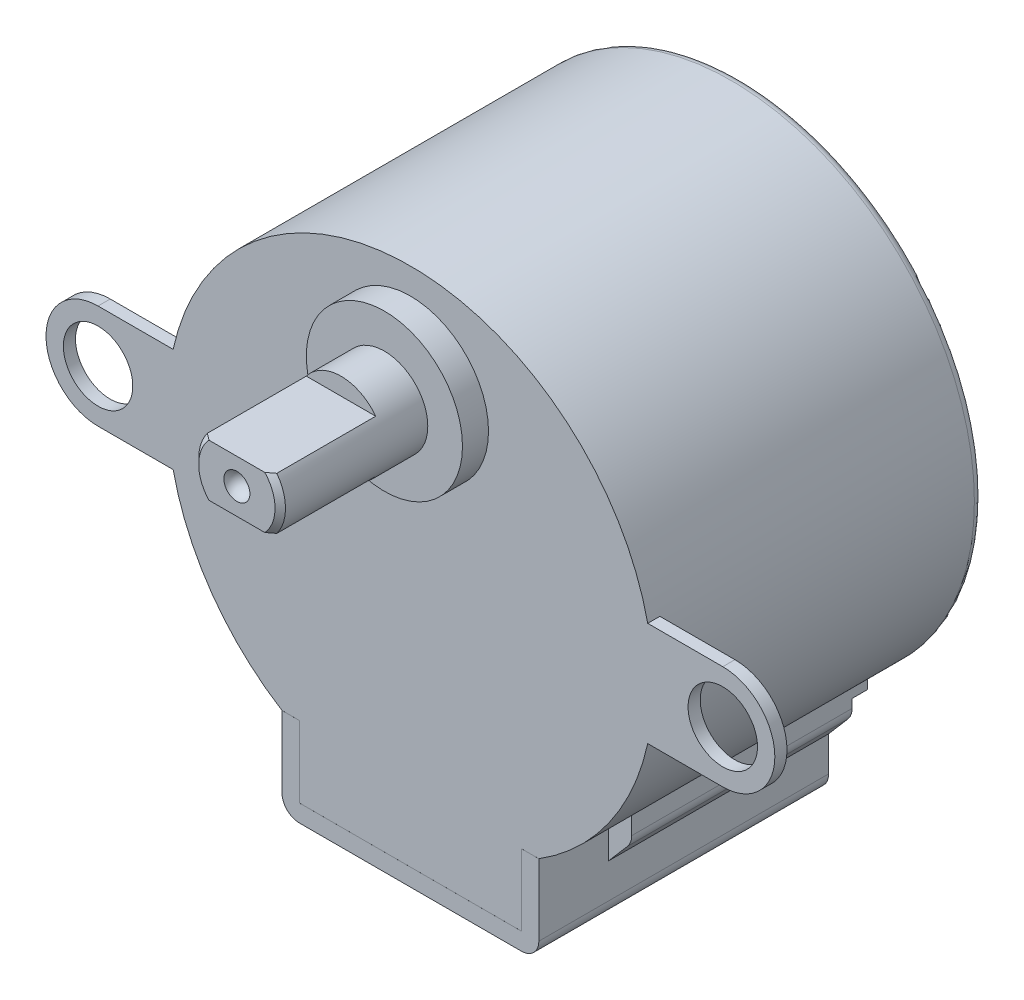
from build123d import *

# Parameters (mm, degrees)
IZIM1_R                     = 14
Y_KSEKLIK_EKSTR_ZYON1_DEPTH = 19
IZIM2_R                     = 4.5
Y_KSEKLIK_EKSTR_ZYON2_DEPTH = 1.5
IZIM3_R                     = 2.5
Y_KSEKLIK_EKSTR_ZYON3_DEPTH = 8.5
KES_EKSTR_ZYON1_DEPTH       = 6
PAH1_SIZE                   = 0.3
Y_KSEKLIK_EKSTR_ZYON4_START = -16.7
Y_KSEKLIK_EKSTR_ZYON4_DEPTH = 16.7
RADYUS2_R                   = 1
Y_KSEKLIK_EKSTR_ZYON5_DEPTH = 12.7
Y_KSEKLIK_EKSTR_ZYON6_START = 0.9
Y_KSEKLIK_EKSTR_ZYON6_DEPTH = 0.9
KES_EKSTR_ZYON2_DEPTH       = 2.3
RADYUS3_R                   = 0.5
Y_KSEKLIK_EKSTR_ZYON7_START = -0.7
IZIM10_R                    = 2
Y_KSEKLIK_EKSTR_ZYON7_DEPTH = 0.7
IZIM11_W                    = 1.346153846
IZIM11_H                    = 0.358974359
KES_EKSTR_ZYON3_DEPTH       = 0.3
Y_KSEKLIK_EKSTR_ZYON8_START = 0.001
Y_KSEKLIK_EKSTR_ZYON8_DEPTH = 0.001


with BuildPart() as part:
    # Çizim1 → Yükseklik-Ekstrüzyon1 (new body)
    with BuildSketch(Plane.XY):
        Circle(IZIM1_R)
    extrude(amount=Y_KSEKLIK_EKSTR_ZYON1_DEPTH)

    # Çizim2 → Yükseklik-Ekstrüzyon2 (add)
    with BuildSketch(Plane.XY.offset(19)):
        with Locations((0, 8)):
            Circle(IZIM2_R)
    extrude(amount=Y_KSEKLIK_EKSTR_ZYON2_DEPTH)

    # Çizim3 → Yükseklik-Ekstrüzyon3 (add)
    with BuildSketch(Plane.XY.offset(20.5)):
        with Locations((0, 8)):
            Circle(IZIM3_R)
    extrude(amount=Y_KSEKLIK_EKSTR_ZYON3_DEPTH)

    # Çizim4 → Kes-Ekstrüzyon1 (cut)
    with BuildSketch(Plane.XY.offset(29)):
        Polygon((0, 9.5), (2.176763418, 9.5), (2.176763418, 10.5), (-2.399726215, 10.5), (-2.399726215, 9.5), align=None)
        Polygon((2.176763418, 5.5), (-2.399726215, 5.5), (-2.399726215, 6.5), (0, 6.5), (2.176763418, 6.5), align=None)
    extrude(amount=-KES_EKSTR_ZYON1_DEPTH, mode=Mode.SUBTRACT)

    # Pah1
    pah1_edges = [part.edges().sort_by_distance(p)[0] for p in [
        (-2.5, 8, 29),
        (2.371708245, 8.790569415, 29),
    ]]
    chamfer(pah1_edges, length=PAH1_SIZE)

    # Çizim5 → Kes-Döndür1 (revolve, cut)
    with BuildSketch(Plane.XY.offset(29)):
        with BuildLine():
            Line((0, 8.75), (0, 7.25))
            ThreePointArc((0, 7.25), (0.75, 8), (0, 8.75))
        make_face()
    revolve(axis=Axis((0, 8.75, 29), (0, -1, 0)), mode=Mode.SUBTRACT)

    # Çizim6 → Yükseklik-Ekstrüzyon4 (add)
    with BuildSketch(Plane.XY.offset(19).offset(Y_KSEKLIK_EKSTR_ZYON4_START)):
        with BuildLine():
            Line((0, -17), (7.4, -17))
            Line((7.4, -17), (7.4, -11.884443613))
            ThreePointArc((7.4, -11.884443613), (0, -14), (-7.4, -11.884443613))
            Line((-7.4, -11.884443613), (-7.4, -17))
            Line((-7.4, -17), (0, -17))
        make_face()
    extrude(amount=Y_KSEKLIK_EKSTR_ZYON4_DEPTH)

    # Radyus2
    radyus2_edges = [part.edges().sort_by_distance(p)[0] for p in [
        (-7.4, -17, 10.65),
        (7.4, -17, 10.65),
    ]]
    fillet(radyus2_edges, radius=RADYUS2_R)

    # Çizim7 → Yükseklik-Ekstrüzyon5 (add)
    with BuildSketch(Plane(origin=(0, 0, 2.3), x_dir=(-1, 0, 0), z_dir=(0, 0, -1))):
        with BuildLine():
            Line((7.4, -14), (7.4, -10.928746497))
            Line((7.4, -10.928746497), (8.75, -10.928746497))
            Line((8.75, -10.928746497), (8.75, -12.058153251))
            ThreePointArc((8.75, -12.058153251), (8.687680677, -12.405651377), (8.508490105, -12.709837807))
            Line((8.508490105, -12.709837807), (7.4, -14))
        make_face()
        with BuildLine():
            Line((-7.4, -14), (-7.4, -10.928746497))
            Line((-7.4, -10.928746497), (-8.75, -10.928746497))
            Line((-8.75, -10.928746497), (-8.75, -12.058153251))
            ThreePointArc((-8.75, -12.058153251), (-8.687680677, -12.405651377), (-8.508490105, -12.709837807))
            Line((-8.508490105, -12.709837807), (-7.4, -14))
        make_face()
    extrude(amount=-Y_KSEKLIK_EKSTR_ZYON5_DEPTH)

    # Çizim8 → Yükseklik-Ekstrüzyon6 (add)
    with BuildSketch(Plane(origin=(0, 0, 2.3), x_dir=(-1, 0, 0), z_dir=(0, 0, -1)).offset(Y_KSEKLIK_EKSTR_ZYON6_START)):
        with BuildLine():
            Line((-8.75, -10.928746497), (-8.75, -11.56233108))
            ThreePointArc((-8.75, -11.56233108), (-5.320746645, -13.488500849), (-1.5, -14.422205102))
            Line((-1.5, -14.422205102), (-1.5, -13.919410907))
            ThreePointArc((-1.5, -13.919410907), (-5.338693043, -12.942115615), (-8.75, -10.928746497))
        make_face()
        with BuildLine():
            Line((8.75, -10.928746497), (8.75, -11.56233108))
            ThreePointArc((8.75, -11.56233108), (5.320746645, -13.488500849), (1.5, -14.422205102))
            Line((1.5, -14.422205102), (1.5, -13.919410907))
            ThreePointArc((1.5, -13.919410907), (5.338693043, -12.942115615), (8.75, -10.928746497))
        make_face()
    extrude(amount=-Y_KSEKLIK_EKSTR_ZYON6_DEPTH)

    # Çizim9 → Kes-Ekstrüzyon2 (cut)
    with BuildSketch(Plane.XZ.offset(17)):
        with BuildLine():
            Line((3.2, 17), (-3.2, 17))
            ThreePointArc((-3.2, 17), (-3.7, 16.5), (-3.2, 16))
            Line((-3.2, 16), (3.2, 16))
            ThreePointArc((3.2, 16), (3.7, 16.5), (3.2, 17))
        make_face()
    extrude(amount=-KES_EKSTR_ZYON2_DEPTH, mode=Mode.SUBTRACT)

    # Radyus3
    radyus3_edges = [part.edges().sort_by_distance(p)[0] for p in [
        (-14, 0, 0),
    ]]
    fillet(radyus3_edges, radius=RADYUS3_R)

    # Çizim10 → Yükseklik-Ekstrüzyon7 (add)
    # profile 1 of 2: a face of its own
    with BuildSketch(Plane.XY.offset(19).offset(Y_KSEKLIK_EKSTR_ZYON7_START)):
        with BuildLine():
            Line((18, 3), (13.674794331, 3))
            ThreePointArc((13.674794331, 3), (14, 0), (13.674794331, -3))
            Line((13.674794331, -3), (18, -3))
            ThreePointArc((18, -3), (21, 0), (18, 3))
        make_face()
        with Locations((18, 0)):
            Circle(IZIM10_R, mode=Mode.SUBTRACT)
    # profile 2 of 2: a face of its own
    with BuildSketch(Plane.XY.offset(19).offset(Y_KSEKLIK_EKSTR_ZYON7_START)):
        with BuildLine():
            Line((-18, -3), (-13.674794331, -3))
            ThreePointArc((-13.674794331, -3), (-14, 0), (-13.674794331, 3))
            Line((-13.674794331, 3), (-18, 3))
            ThreePointArc((-18, 3), (-21, 0), (-18, -3))
        make_face()
        with Locations(Location((-18, 0, 0), (0, 0, 180))):
            Circle(IZIM10_R, mode=Mode.SUBTRACT)
    extrude(amount=Y_KSEKLIK_EKSTR_ZYON7_DEPTH)

    # Çizim11 → Kes-Ekstrüzyon3 (cut)
    # profile 1 of 8: a face of its own
    with BuildSketch(Plane(origin=(0, 0, 0), x_dir=(-1, 0, 0), z_dir=(0, 0, -1))):
        with BuildLine():
            Line((-9.138088726, 0.683464408), (-9.45219129, 0.683464408))
            add(Edge.make_bspline(
                [(-9.45219129, 0.683464408), (-9.450144137, 0.725135295), (-9.446123583, 0.80697581), (-9.427295294, 0.926299716), (-9.400354417, 1.040354515), (-9.362262963, 1.148224429), (-9.314956685, 1.250863236), (-9.258226658, 1.347863252), (-9.191032807, 1.438854441), (-9.114826073, 1.522993284), (-9.032057434, 1.600180855), (-8.942751494, 1.666836098), (-8.848906467, 1.723153769), (-8.750807068, 1.770235011), (-8.647346505, 1.805574857), (-8.539463647, 1.831796496), (-8.42668451, 1.847572842), (-8.349844488, 1.849268628), (-8.310765008, 1.850131074)],
                knots=[0, 0, 0, 0, 1.10065271, 2.161652631, 3.183658789, 4.190468796, 5.17591951, 6.163126047, 7.15150782, 8.156236427, 9.156009102, 10.134482811, 11.092018607, 12.041330605, 13.001268258, 13.972401359, 14.968799086, 16, 16, 16, 16], degree=3))
            add(Edge.make_bspline(
                [(-8.310765008, 1.850131074), (-8.272386934, 1.849232618), (-8.196975389, 1.847467183), (-8.086913375, 1.832306154), (-7.982136081, 1.808560562), (-7.882848314, 1.775245146), (-7.789842249, 1.730460718), (-7.702419205, 1.67666318), (-7.619538394, 1.614443348), (-7.54493161, 1.541189535), (-7.476423531, 1.46298715), (-7.417321276, 1.379499247), (-7.366708113, 1.293269961), (-7.324520433, 1.203641759), (-7.293464294, 1.109770731), (-7.269886086, 1.013023528), (-7.256558672, 0.912398717), (-7.254513249, 0.844292162), (-7.253473341, 0.809666331)],
                knots=[0, 0, 0, 0, 1.111607364, 2.184268762, 3.212621178, 4.221274766, 5.211760367, 6.196651075, 7.1921475, 8.207485113, 9.220403448, 10.201281604, 11.166441695, 12.114753415, 13.065576456, 14.026450734, 14.996634279, 16, 16, 16, 16], degree=3))
            add(Edge.make_bspline(
                [(-7.253473341, 0.809666331), (-7.255166604, 0.760918496), (-7.258523416, 0.664278282), (-7.287237792, 0.52226342), (-7.332084303, 0.384670001), (-7.38608166, 0.273932698), (-7.440554104, 0.184699205), (-7.489641612, 0.1112305), (-7.547106423, 0.032125031), (-7.613784921, -0.052352306), (-7.688297793, -0.142863211), (-7.771319956, -0.239353006), (-7.863443438, -0.340824776), (-7.928101939, -0.410130378), (-7.961606354, -0.446042804)],
                knots=[0, 0, 0, 0, 1.184426356, 2.348067706, 3.509069118, 4.696110526, 5.333549288, 6.050745305, 6.844228056, 7.710549037, 8.667450064, 9.695053472, 10.805634456, 12, 12, 12, 12], degree=3))
            Line((-7.961606354, -0.446042804), (-8.837307476, -1.380638157))
            Line((-8.837307476, -1.380638157), (-7.208601547, -1.380638157))
            Line((-7.208601547, -1.380638157), (-7.208601547, -1.739612516))
            Line((-7.208601547, -1.739612516), (-9.586806675, -1.739612516))
            Line((-9.586806675, -1.739612516), (-8.22943488, -0.291094887))
            add(Edge.make_bspline(
                [(-8.22943488, -0.291094887), (-8.196386993, -0.256596581), (-8.132908766, -0.190332394), (-8.043126189, -0.093589434), (-7.962487201, -0.003839893), (-7.890469808, 0.078746655), (-7.828636303, 0.155378223), (-7.773764071, 0.223572927), (-7.72979848, 0.286327377), (-7.682083084, 0.359067991), (-7.635869103, 0.447880308), (-7.596156747, 0.556413997), (-7.571941898, 0.66814125), (-7.569037063, 0.743643287), (-7.567575906, 0.781621459)],
                knots=[0, 0, 0, 0, 1.329631726, 2.553950428, 3.673215718, 4.687767853, 5.603093632, 6.413772471, 7.123043292, 7.734684054, 8.834405432, 9.900288307, 10.943827018, 12, 12, 12, 12], degree=3))
            add(Edge.make_bspline(
                [(-7.567575906, 0.781621459), (-7.568211648, 0.805502857), (-7.569464574, 0.852568508), (-7.580522271, 0.921574267), (-7.597232777, 0.98813908), (-7.621178036, 1.0524677), (-7.652784776, 1.113913352), (-7.691258156, 1.172550832), (-7.735648219, 1.229239797), (-7.786999488, 1.282393095), (-7.843411008, 1.331074301), (-7.903005258, 1.374198386), (-7.966055362, 1.410237497), (-8.032295484, 1.439780994), (-8.101540954, 1.462956375), (-8.173925699, 1.479014955), (-8.249249715, 1.489097439), (-8.300683211, 1.49046161), (-8.326890809, 1.491156715)],
                knots=[0, 0, 0, 0, 0.991446411, 1.95395049, 2.89581595, 3.838931463, 4.798493298, 5.75982156, 6.748411868, 7.785213223, 8.824556874, 9.840280684, 10.836137867, 11.835679398, 12.848801643, 13.863922112, 14.911575587, 16, 16, 16, 16], degree=3))
            add(Edge.make_bspline(
                [(-8.326890809, 1.491156715), (-8.354261642, 1.490441683), (-8.408013438, 1.489037478), (-8.486932471, 1.479214814), (-8.562218249, 1.462268973), (-8.634060152, 1.439092299), (-8.702579738, 1.40963375), (-8.767443782, 1.372942005), (-8.828506671, 1.329158512), (-8.885883194, 1.279517956), (-8.938747173, 1.224250355), (-8.985194049, 1.162640392), (-9.025778063, 1.095812976), (-9.061187297, 1.023948426), (-9.089942987, 0.946394646), (-9.111916137, 0.863426941), (-9.129302984, 0.775405559), (-9.135111505, 0.714620475), (-9.138088726, 0.683464408)],
                knots=[0, 0, 0, 0, 1.031018746, 2.02475058, 2.990194455, 3.934040569, 4.864654155, 5.795059489, 6.735614925, 7.690564532, 8.649604399, 9.611025574, 10.590972636, 11.591080095, 12.624614302, 13.701020113, 14.821632451, 16, 16, 16, 16], degree=3))
        make_face()
    # profile 2 of 8: a face of its own
    with BuildSketch(Plane(origin=(0, 0, 0), x_dir=(-1, 0, 0), z_dir=(0, 0, -1))):
        with BuildLine():
            add(Edge.make_bspline(
                [(-5.192876386, 0.210207196), (-5.164227839, 0.19526924), (-5.108353605, 0.166135237), (-5.028776396, 0.119224409), (-4.956051395, 0.069783445), (-4.888160833, 0.020147585), (-4.826297483, -0.031584066), (-4.77115307, -0.085617222), (-4.72136545, -0.140603168), (-4.677938666, -0.197473008), (-4.639741829, -0.256075657), (-4.606729694, -0.31656493), (-4.578512491, -0.378808264), (-4.556149552, -0.443485094), (-4.537727761, -0.509645355), (-4.525052156, -0.578143337), (-4.518235238, -0.648527678), (-4.516946424, -0.69609598), (-4.516293854, -0.720181426)],
                knots=[0, 0, 0, 0, 1.272397273, 2.481599622, 3.635517121, 4.734568067, 5.792894095, 6.808321871, 7.773003508, 8.711915296, 9.623354172, 10.525449501, 11.423591555, 12.311487226, 13.218079475, 14.126165749, 15.051214107, 16, 16, 16, 16], degree=3))
            add(Edge.make_bspline(
                [(-4.516293854, -0.720181426), (-4.517065275, -0.753879158), (-4.518592206, -0.820579615), (-4.53189219, -0.919025727), (-4.551805168, -1.014637509), (-4.58088468, -1.107393999), (-4.618598071, -1.196783373), (-4.665074907, -1.282882146), (-4.717686112, -1.367101455), (-4.759938352, -1.418920857), (-4.781317893, -1.445141362)],
                knots=[0, 0, 0, 0, 1.025265484, 2.029385089, 3.018602448, 3.995076438, 4.983346944, 5.966715145, 6.97116228, 8, 8, 8, 8], degree=3))
            add(Edge.make_bspline(
                [(-4.781317893, -1.445141362), (-4.809154367, -1.475735136), (-4.864483333, -1.536544629), (-4.95926626, -1.615495439), (-5.063288144, -1.681844833), (-5.176146477, -1.735916727), (-5.297539578, -1.778002586), (-5.427441583, -1.808245104), (-5.566105736, -1.825567533), (-5.661411207, -1.828071523), (-5.710304271, -1.829356105)],
                knots=[0, 0, 0, 0, 0.954267603, 1.896743057, 2.838368354, 3.796610408, 4.779680527, 5.799409237, 6.871065594, 8, 8, 8, 8], degree=3))
            add(Edge.make_bspline(
                [(-5.710304271, -1.829356105), (-5.75731766, -1.828203627), (-5.848800939, -1.825961022), (-5.981958816, -1.810766591), (-6.106081886, -1.784138724), (-6.221891854, -1.747694115), (-6.328690548, -1.700283886), (-6.426173649, -1.641275478), (-6.515747621, -1.573044035), (-6.594694095, -1.493629957), (-6.664782538, -1.408572085), (-6.726350592, -1.320820475), (-6.77752467, -1.230367118), (-6.820851765, -1.13856075), (-6.854019788, -1.044114596), (-6.876991998, -0.947514583), (-6.891581312, -0.84892944), (-6.893522447, -0.782397787), (-6.894498983, -0.748927419)],
                knots=[0, 0, 0, 0, 1.256902934, 2.445805442, 3.576955095, 4.645999104, 5.686449165, 6.692658513, 7.68621702, 8.689161843, 9.678783111, 10.630372946, 11.551080876, 12.453998257, 13.34127905, 14.221779781, 15.105423033, 16, 16, 16, 16], degree=3))
            add(Edge.make_bspline(
                [(-6.894498983, -0.748927419), (-6.893921101, -0.724368227), (-6.892779005, -0.675830595), (-6.884874156, -0.604121267), (-6.872165695, -0.534325132), (-6.854906238, -0.466184389), (-6.831515212, -0.400195116), (-6.803273079, -0.336044643), (-6.770341126, -0.273660544), (-6.732259961, -0.212701663), (-6.687957937, -0.15402215), (-6.637794287, -0.096626156), (-6.580766419, -0.041404289), (-6.51750876, 0.012318136), (-6.44874422, 0.06549411), (-6.37268669, 0.115249839), (-6.291352422, 0.165107804), (-6.233547016, 0.194916129), (-6.203894015, 0.210207196)],
                knots=[0, 0, 0, 0, 0.941657376, 1.861047343, 2.762797495, 3.66048619, 4.553285746, 5.444104102, 6.34607688, 7.256116206, 8.197091036, 9.162375105, 10.176350973, 11.237807142, 12.343728897, 13.50695164, 14.721116704, 16, 16, 16, 16], degree=3))
            add(Edge.make_bspline(
                [(-6.203894015, 0.210207196), (-6.244485389, 0.232341965), (-6.323081652, 0.275201072), (-6.427151093, 0.353947878), (-6.516541717, 0.439235693), (-6.588796434, 0.532865488), (-6.645668662, 0.631912362), (-6.684687267, 0.735756615), (-6.711083751, 0.842472728), (-6.713698578, 0.915378925), (-6.715011803, 0.951994055)],
                knots=[0, 0, 0, 0, 1.166880483, 2.259407225, 3.286803203, 4.280235371, 5.237608625, 6.161067461, 7.076446754, 8, 8, 8, 8], degree=3))
            add(Edge.make_bspline(
                [(-6.715011803, 0.951994055), (-6.713376379, 0.989291613), (-6.710088891, 1.06426621), (-6.683505571, 1.175872334), (-6.640185504, 1.285488899), (-6.581264507, 1.392584611), (-6.507877291, 1.493534826), (-6.419830745, 1.584075772), (-6.319227448, 1.663387255), (-6.206569581, 1.729963428), (-6.085333346, 1.784147086), (-5.957417622, 1.821525509), (-5.825051129, 1.845961626), (-5.734953409, 1.848728281), (-5.689270617, 1.850131074)],
                knots=[0, 0, 0, 0, 0.888701115, 1.786444228, 2.72001202, 3.692817113, 4.693886446, 5.687152267, 6.695133018, 7.739871481, 8.800368666, 9.853104506, 10.91144658, 12, 12, 12, 12], degree=3))
            add(Edge.make_bspline(
                [(-5.689270617, 1.850131074), (-5.644766802, 1.848684731), (-5.557010349, 1.845832707), (-5.428015721, 1.822045829), (-5.304590844, 1.782316309), (-5.187161345, 1.728419086), (-5.077829478, 1.662032145), (-4.981227168, 1.581631271), (-4.895894586, 1.491489721), (-4.825310192, 1.390570117), (-4.767147303, 1.283885924), (-4.726646402, 1.172263403), (-4.700694428, 1.058114344), (-4.697421063, 0.98087634), (-4.695781034, 0.94217835)],
                knots=[0, 0, 0, 0, 1.072916533, 2.115669174, 3.151510826, 4.193348718, 5.225979165, 6.227137561, 7.216255879, 8.211077061, 9.189680878, 10.138522389, 11.067357538, 12, 12, 12, 12], degree=3))
            add(Edge.make_bspline(
                [(-4.695781034, 0.94217835), (-4.697215594, 0.904201686), (-4.70003299, 0.829617677), (-4.72373293, 0.720891156), (-4.763646243, 0.619069117), (-4.818140406, 0.522996165), (-4.889165894, 0.434414667), (-4.975774627, 0.352198198), (-5.077276105, 0.275671369), (-5.153536991, 0.232485005), (-5.192876386, 0.210207196)],
                knots=[0, 0, 0, 0, 0.975232327, 1.915300861, 2.843280834, 3.77672583, 4.742871857, 5.749627742, 6.839139064, 8, 8, 8, 8], degree=3))
        make_face()
        with BuildLine():
            add(Edge.make_bspline(
                [(-5.706798662, 1.491156715), (-5.731349468, 1.490505275), (-5.779381579, 1.489230772), (-5.84981025, 1.482572135), (-5.916782617, 1.469618918), (-5.980998418, 1.452380207), (-6.04157723, 1.429092219), (-6.099341785, 1.401697209), (-6.153308975, 1.368391144), (-6.204130278, 1.331029946), (-6.249881052, 1.28993704), (-6.290485604, 1.247123321), (-6.324213718, 1.201747929), (-6.352854828, 1.154939569), (-6.373636345, 1.105308993), (-6.389200649, 1.054377817), (-6.39972204, 1.001502433), (-6.40051043, 0.965365922), (-6.400909239, 0.947086202)],
                knots=[0, 0, 0, 0, 1.203892937, 2.355340988, 3.463153438, 4.544400666, 5.610487187, 6.640501085, 7.674077295, 8.714426146, 9.728707835, 10.68524104, 11.601827946, 12.495867327, 13.368432065, 14.231010473, 15.105153427, 16, 16, 16, 16], degree=3))
            add(Edge.make_bspline(
                [(-6.400909239, 0.947086202), (-6.400221872, 0.928805693), (-6.398863536, 0.89268078), (-6.388358408, 0.839334914), (-6.372701553, 0.786913277), (-6.348050892, 0.736662366), (-6.318484534, 0.686839007), (-6.281993058, 0.638688421), (-6.23850403, 0.592043036), (-6.189476589, 0.547299595), (-6.136065052, 0.505400832), (-6.079481008, 0.46902765), (-6.020434617, 0.43859354), (-5.959532548, 0.413264135), (-5.8961541, 0.393574198), (-5.830687627, 0.379605551), (-5.763122125, 0.370923554), (-5.717341544, 0.369886533), (-5.69417847, 0.369361843)],
                knots=[0, 0, 0, 0, 0.873023192, 1.725219244, 2.590779336, 3.480155217, 4.391973325, 5.357036234, 6.360879153, 7.436073238, 8.526419356, 9.601555421, 10.645666583, 11.697338044, 12.750135903, 13.812665442, 14.89329948, 16, 16, 16, 16], degree=3))
            add(Edge.make_bspline(
                [(-5.69417847, 0.369361843), (-5.664428366, 0.370234711), (-5.605221998, 0.371971824), (-5.517942667, 0.388122997), (-5.433080022, 0.413528915), (-5.351541118, 0.448288881), (-5.275436533, 0.491916741), (-5.207596464, 0.544149759), (-5.148599572, 0.603781856), (-5.099058961, 0.669884692), (-5.060649115, 0.740236281), (-5.030747307, 0.810836573), (-5.013286092, 0.882438804), (-5.011008525, 0.930405768), (-5.009883598, 0.95409742)],
                knots=[0, 0, 0, 0, 1.076279235, 2.141928126, 3.20205304, 4.278698113, 5.344010996, 6.36967002, 7.368914609, 8.37248503, 9.349703398, 10.264243087, 11.142681841, 12, 12, 12, 12], degree=3))
            add(Edge.make_bspline(
                [(-5.009883598, 0.95409742), (-5.010415495, 0.970725456), (-5.011471236, 1.003729724), (-5.020171292, 1.05246809), (-5.034547125, 1.100097673), (-5.054010205, 1.147011944), (-5.07962, 1.192552676), (-5.109984187, 1.237435764), (-5.146868689, 1.280651528), (-5.188265122, 1.323207076), (-5.235210531, 1.3625911), (-5.287614443, 1.39722581), (-5.345208193, 1.426638167), (-5.407993143, 1.450526921), (-5.475738067, 1.468469271), (-5.548130942, 1.481905619), (-5.625775389, 1.48947873), (-5.67920514, 1.490585256), (-5.706798662, 1.491156715)],
                knots=[0, 0, 0, 0, 0.814439003, 1.616544685, 2.417341072, 3.248991801, 4.09997495, 4.973547432, 5.9003056, 6.880240646, 7.880314356, 8.896779544, 9.951930927, 11.043077905, 12.18215768, 13.381699519, 14.647792085, 16, 16, 16, 16], degree=3))
        make_face(mode=Mode.SUBTRACT)
        with BuildLine():
            add(Edge.make_bspline(
                [(-5.68646613, 0.010387484), (-5.717591916, 0.009833843), (-5.778653112, 0.008747734), (-5.86811004, -0.003341767), (-5.953963206, -0.02017116), (-6.035923142, -0.045701998), (-6.113955239, -0.078898488), (-6.188481921, -0.118833028), (-6.258933051, -0.166038472), (-6.324335777, -0.219915087), (-6.384059107, -0.277974541), (-6.436457407, -0.339436676), (-6.480954927, -0.403159209), (-6.516788178, -0.469951438), (-6.54619991, -0.538399049), (-6.565513787, -0.610206644), (-6.577895499, -0.683993758), (-6.579558131, -0.734153856), (-6.580396418, -0.759444246)],
                knots=[0, 0, 0, 0, 1.140299081, 2.23698856, 3.303958914, 4.344563908, 5.37730929, 6.408454204, 7.439741482, 8.480804886, 9.510774543, 10.48932336, 11.43758569, 12.353841022, 13.263987381, 14.161954604, 15.073269652, 16, 16, 16, 16], degree=3))
            add(Edge.make_bspline(
                [(-6.580396418, -0.759444246), (-6.57903316, -0.790875152), (-6.576328486, -0.853233336), (-6.554871847, -0.945396407), (-6.520436312, -1.034617462), (-6.472411096, -1.120169415), (-6.412943523, -1.200119521), (-6.339817055, -1.269808297), (-6.257576218, -1.331729775), (-6.163438364, -1.381810309), (-6.060609897, -1.421805164), (-5.949118169, -1.449361126), (-5.83056325, -1.467602576), (-5.748703658, -1.469440757), (-5.706798662, -1.470381746)],
                knots=[0, 0, 0, 0, 0.898778495, 1.783155532, 2.693654817, 3.627872908, 4.583023416, 5.533784346, 6.509005473, 7.520592997, 8.575161974, 9.658835044, 10.801527049, 12, 12, 12, 12], degree=3))
            add(Edge.make_bspline(
                [(-5.706798662, -1.470381746), (-5.674048294, -1.469752938), (-5.610240075, -1.468527817), (-5.517154126, -1.457713523), (-5.429309578, -1.440563898), (-5.346876779, -1.415620353), (-5.268932939, -1.385170376), (-5.196799585, -1.345998295), (-5.128621058, -1.301445972), (-5.067756936, -1.248587815), (-5.012323727, -1.19210832), (-4.963990434, -1.132318277), (-4.922032883, -1.070842645), (-4.889101927, -1.00629216), (-4.862775674, -0.939905246), (-4.843852119, -0.871069734), (-4.832175904, -0.799574501), (-4.830995008, -0.75107543), (-4.830396418, -0.726491522)],
                knots=[0, 0, 0, 0, 1.224942928, 2.386581632, 3.501229538, 4.569074225, 5.605009692, 6.626002462, 7.634866581, 8.645888296, 9.63523824, 10.59253846, 11.518950513, 12.414518923, 13.29783783, 14.186679152, 15.080837789, 16, 16, 16, 16], degree=3))
            add(Edge.make_bspline(
                [(-4.830396418, -0.726491522), (-4.831302267, -0.702614181), (-4.833088442, -0.655532237), (-4.844425133, -0.58576571), (-4.864341011, -0.518362896), (-4.891668407, -0.45251289), (-4.92804937, -0.389549939), (-4.97089424, -0.327833768), (-5.022588359, -0.269077323), (-5.081000955, -0.212824227), (-5.144659916, -0.160808491), (-5.21232706, -0.114794052), (-5.283481522, -0.076041936), (-5.357972733, -0.04452544), (-5.435635289, -0.019737971), (-5.516412068, -0.002421975), (-5.600397643, 0.008477627), (-5.657452513, 0.009743673), (-5.68646613, 0.010387484)],
                knots=[0, 0, 0, 0, 0.917430815, 1.809013306, 2.70690318, 3.612392954, 4.541220862, 5.495268465, 6.494511384, 7.542276156, 8.608045339, 9.649016899, 10.681629292, 11.715607085, 12.752076957, 13.808767841, 14.885711793, 16, 16, 16, 16], degree=3))
        make_face(mode=Mode.SUBTRACT)
    # profile 3 of 8: a face of its own
    with BuildSketch(Plane(origin=(0, 0, 0), x_dir=(-1, 0, 0), z_dir=(0, 0, -1))):
        with BuildLine():
            Line((-3.888088726, 1.760387484), (-3.205196098, 1.760387484))
            add(Edge.make_bspline(
                [(-3.205196098, 1.760387484), (-3.17176762, 1.760211734), (-3.106974909, 1.759871086), (-3.012755468, 1.754587955), (-2.924506657, 1.747384285), (-2.842202885, 1.735954192), (-2.765882182, 1.722162415), (-2.695314545, 1.705460599), (-2.630724373, 1.685433985), (-2.553611636, 1.653587704), (-2.465690975, 1.606264536), (-2.370492583, 1.536335971), (-2.289088343, 1.450803508), (-2.218902026, 1.354320852), (-2.163100906, 1.24818508), (-2.122731609, 1.134925892), (-2.097173734, 1.01600415), (-2.0945453, 0.934360972), (-2.093216931, 0.893099824)],
                knots=[0, 0, 0, 0, 1.001505555, 1.941167018, 2.826882275, 3.653841531, 4.429895133, 5.150066043, 5.825578002, 6.45369114, 7.647487171, 8.808567382, 9.977351308, 11.170798116, 12.373658725, 13.556498008, 14.765093433, 16, 16, 16, 16], degree=3))
            add(Edge.make_bspline(
                [(-2.093216931, 0.893099824), (-2.09431015, 0.854447269), (-2.096458427, 0.778491351), (-2.117001186, 0.667397242), (-2.149161855, 0.561646023), (-2.193867104, 0.461623638), (-2.2519691, 0.369590025), (-2.320827419, 0.284802759), (-2.403904221, 0.210851702), (-2.466147461, 0.169508799), (-2.497764207, 0.148508478)],
                knots=[0, 0, 0, 0, 1.044552857, 2.05264487, 3.044412934, 4.028983338, 5.005914585, 5.980388656, 6.974128949, 8, 8, 8, 8], degree=3))
            add(Edge.make_bspline(
                [(-2.497764207, 0.148508478), (-2.458003779, 0.133243479), (-2.381932232, 0.104037755), (-2.277246219, 0.052402291), (-2.187051374, -0.00375982), (-2.110654228, -0.06509167), (-2.045316574, -0.131200481), (-1.988263632, -0.203055595), (-1.939582258, -0.281594353), (-1.897869334, -0.365997888), (-1.865320578, -0.455404356), (-1.840944674, -0.548975133), (-1.826977225, -0.646374688), (-1.824989583, -0.712660067), (-1.823986162, -0.746122932)],
                knots=[0, 0, 0, 0, 1.27268992, 2.434971085, 3.483601985, 4.442670788, 5.356604649, 6.2567628, 7.179492994, 8.113709626, 9.066344395, 10.018646069, 10.999752585, 12, 12, 12, 12], degree=3))
            add(Edge.make_bspline(
                [(-1.823986162, -0.746122932), (-1.824963008, -0.780289804), (-1.82688498, -0.847514082), (-1.841064952, -0.946269217), (-1.865074059, -1.040644164), (-1.898145205, -1.131249346), (-1.94130752, -1.217909481), (-1.993835484, -1.300722745), (-2.056467048, -1.378857075), (-2.126529917, -1.453180698), (-2.205792062, -1.520008486), (-2.291307817, -1.579524193), (-2.384154137, -1.628470255), (-2.482806131, -1.669586276), (-2.588370447, -1.700993475), (-2.700373054, -1.722966048), (-2.818717356, -1.737771085), (-2.899927107, -1.73898829), (-2.941574303, -1.739612516)],
                knots=[0, 0, 0, 0, 0.978564426, 1.925352924, 2.850884081, 3.763762016, 4.682927383, 5.618979971, 6.567305752, 7.547517671, 8.540179244, 9.531824382, 10.526200242, 11.540722885, 12.589160233, 13.674978461, 14.80764778, 16, 16, 16, 16], degree=3))
            Line((-2.941574303, -1.739612516), (-3.888088726, -1.739612516))
            Line((-3.888088726, -1.739612516), (-3.888088726, 1.760387484))
        make_face()
        with BuildLine():
            Line((-3.573986162, 1.401413125), (-3.573986162, 0.279618254))
            Line((-3.573986162, 0.279618254), (-3.362948502, 0.279618254))
            add(Edge.make_bspline(
                [(-3.362948502, 0.279618254), (-3.332099706, 0.280018177), (-3.272493547, 0.280790909), (-3.186173651, 0.283004426), (-3.106048632, 0.28920247), (-3.032256799, 0.295398732), (-2.964914355, 0.30547332), (-2.904170494, 0.317465443), (-2.849071897, 0.330148348), (-2.785532351, 0.351717835), (-2.713459403, 0.38359551), (-2.636626299, 0.433067346), (-2.568891829, 0.491991699), (-2.511694641, 0.559982661), (-2.464883171, 0.634848847), (-2.432369456, 0.715395727), (-2.410322172, 0.799615859), (-2.40833064, 0.857434112), (-2.407319495, 0.886789728)],
                knots=[0, 0, 0, 0, 1.156816544, 2.235205308, 3.236616184, 4.169592532, 5.011045266, 5.787822928, 6.49130361, 7.128639758, 8.301311294, 9.436451833, 10.541879658, 11.654887649, 12.756523258, 13.837046038, 14.901820046, 16, 16, 16, 16], degree=3))
            add(Edge.make_bspline(
                [(-2.407319495, 0.886789728), (-2.407845676, 0.9062155), (-2.408877835, 0.944321272), (-2.417331138, 0.999870626), (-2.431698712, 1.052114378), (-2.450153006, 1.101768489), (-2.475941694, 1.147280339), (-2.506305158, 1.190223535), (-2.542990848, 1.229135653), (-2.584748161, 1.265505151), (-2.632756784, 1.297749679), (-2.686988075, 1.325990442), (-2.748175752, 1.348731219), (-2.815288607, 1.368647372), (-2.889359695, 1.382635665), (-2.969534248, 1.394289053), (-3.056468967, 1.400221795), (-3.11661407, 1.401007158), (-3.147704111, 1.401413125)],
                knots=[0, 0, 0, 0, 0.91205012, 1.789085906, 2.630437955, 3.453916878, 4.269457761, 5.079663411, 5.91843418, 6.774407191, 7.675494373, 8.627863946, 9.638891023, 10.736472738, 11.911756761, 13.175263542, 14.539845004, 16, 16, 16, 16], degree=3))
            Line((-3.147704111, 1.401413125), (-3.573986162, 1.401413125))
        make_face(mode=Mode.SUBTRACT)
        with BuildLine():
            Line((-3.573986162, -0.079356105), (-3.573986162, -1.380638157))
            Line((-3.573986162, -1.380638157), (-3.126670457, -1.380638157))
            add(Edge.make_bspline(
                [(-3.126670457, -1.380638157), (-3.094651531, -1.380254409), (-3.032939272, -1.379514787), (-2.943838042, -1.377100232), (-2.861254938, -1.371607956), (-2.785566803, -1.362962107), (-2.71595635, -1.353583658), (-2.653258647, -1.340972377), (-2.596965454, -1.326523416), (-2.531691146, -1.304189244), (-2.458187638, -1.269492773), (-2.378976781, -1.217178547), (-2.308550563, -1.154855239), (-2.248745304, -1.082724325), (-2.199732315, -1.004292998), (-2.16407686, -0.921147648), (-2.142086004, -0.83466212), (-2.139423834, -0.775695408), (-2.138088726, -0.746122932)],
                knots=[0, 0, 0, 0, 1.160039823, 2.235823828, 3.228722157, 4.157150951, 4.99529583, 5.772374946, 6.472645482, 7.099169577, 8.269452708, 9.405989375, 10.527446681, 11.663510218, 12.788923519, 13.866172445, 14.929861265, 16, 16, 16, 16], degree=3))
            add(Edge.make_bspline(
                [(-2.138088726, -0.746122932), (-2.13836483, -0.727629592), (-2.138912586, -0.69094121), (-2.1471732, -0.637025391), (-2.15918707, -0.584799517), (-2.174718504, -0.534121777), (-2.197337971, -0.485908401), (-2.223744516, -0.439205841), (-2.254705918, -0.393952362), (-2.302950084, -0.336740108), (-2.373122068, -0.270823095), (-2.472828844, -0.206285593), (-2.586201142, -0.154237786), (-2.668428635, -0.13213831), (-2.710905233, -0.120722291)],
                knots=[0, 0, 0, 0, 0.723448775, 1.435228256, 2.130040452, 2.821711965, 3.505591119, 4.210454504, 4.921174351, 5.648778258, 7.137944449, 8.670945889, 10.280296675, 12, 12, 12, 12], degree=3))
            add(Edge.make_bspline(
                [(-2.710905233, -0.120722291), (-2.727934328, -0.117267207), (-2.764856921, -0.109775873), (-2.825064501, -0.101868169), (-2.89380037, -0.094823109), (-2.971223247, -0.089611952), (-3.057431088, -0.084225408), (-3.152608007, -0.082130587), (-3.256365322, -0.079631327), (-3.328357694, -0.079450193), (-3.365752989, -0.079356105)],
                knots=[0, 0, 0, 0, 0.634451884, 1.375622551, 2.216452059, 3.157844607, 4.20941857, 5.370758133, 6.634282058, 8, 8, 8, 8], degree=3))
            Line((-3.365752989, -0.079356105), (-3.573986162, -0.079356105))
        make_face(mode=Mode.SUBTRACT)
    # profile 4 of 8: a face of its own
    with BuildSketch(Plane(origin=(0, 0, 0), x_dir=(-1, 0, 0), z_dir=(0, 0, -1))):
        Polygon((-1.375268213, 1.760387484), (-1.015592733, 1.760387484), (-0.095720938, 0.256481234), (0.822748614, 1.760387484), (1.182424094, 1.760387484), (0.060629223, -0.075850496), (0.060629223, -1.739612516), (-0.253473341, -1.739612516), (-0.253473341, -0.075850496), align=None)
    # profile 5 of 8: a face of its own
    with BuildSketch(Plane(origin=(0, 0, 0), x_dir=(-1, 0, 0), z_dir=(0, 0, -1))):
        with BuildLine():
            Line((2.932424094, 1.760387484), (3.246526659, 1.760387484))
            Line((3.246526659, 1.760387484), (3.246526659, -0.603094086))
            add(Edge.make_bspline(
                [(3.246526659, -0.603094086), (3.24621274, -0.646799257), (3.245609978, -0.730718518), (3.242295567, -0.851592414), (3.236162089, -0.9619631), (3.227227077, -1.062081547), (3.215306844, -1.151634103), (3.201665816, -1.23131272), (3.185153017, -1.300452403), (3.160286551, -1.378087758), (3.119512602, -1.463231563), (3.058145564, -1.555186714), (2.981912768, -1.635620124), (2.893611735, -1.705472849), (2.79247071, -1.76113008), (2.680572491, -1.801085259), (2.558605904, -1.825456116), (2.474006692, -1.828030021), (2.430420889, -1.829356105)],
                knots=[0, 0, 0, 0, 1.237770943, 2.376671248, 3.424123796, 4.367912054, 5.222547132, 5.982086412, 6.656319012, 7.234008312, 8.288027371, 9.317870876, 10.352700517, 11.413286737, 12.494591526, 13.606319346, 14.766767577, 16, 16, 16, 16], degree=3))
            add(Edge.make_bspline(
                [(2.430420889, -1.829356105), (2.396462531, -1.828275496), (2.328136065, -1.826101239), (2.226445356, -1.808379526), (2.12504338, -1.781063483), (2.023391932, -1.741060887), (1.91948269, -1.686655289), (1.811908344, -1.615470472), (1.699285153, -1.527638946), (1.625101866, -1.4606012), (1.586270248, -1.425509951)],
                knots=[0, 0, 0, 0, 0.848567217, 1.707373443, 2.573483905, 3.470863513, 4.432650262, 5.500696352, 6.691726801, 8, 8, 8, 8], degree=3))
            Line((1.586270248, -1.425509951), (1.771366402, -1.156279182))
            add(Edge.make_bspline(
                [(1.771366402, -1.156279182), (1.814069081, -1.185726578), (1.894697307, -1.241327102), (2.013201748, -1.312853703), (2.118198901, -1.374178868), (2.186881848, -1.405431147), (2.218682107, -1.419900977)],
                knots=[0, 0, 0, 0, 1.196737151, 2.259595785, 3.194191475, 4, 4, 4, 4], degree=3))
            add(Edge.make_bspline(
                [(2.218682107, -1.419900977), (2.237966419, -1.427460434), (2.275787248, -1.442286214), (2.333612328, -1.458832112), (2.391107365, -1.467874522), (2.429225059, -1.469555855), (2.447948934, -1.470381746)],
                knots=[0, 0, 0, 0, 1.051806502, 2.062826769, 3.048436908, 4, 4, 4, 4], degree=3))
            add(Edge.make_bspline(
                [(2.447948934, -1.470381746), (2.472131723, -1.469359011), (2.519932179, -1.467337442), (2.589396173, -1.449488166), (2.655854204, -1.422243763), (2.716923862, -1.382352469), (2.773209249, -1.334921049), (2.819652074, -1.27756504), (2.858369319, -1.213999056), (2.881669012, -1.153827602), (2.896513784, -1.098950972), (2.905935411, -1.048517836), (2.914174072, -0.989556358), (2.921355623, -0.921996157), (2.925560094, -0.845701975), (2.930277367, -0.760897832), (2.931982628, -0.66736992), (2.932272449, -0.602158968), (2.932424094, -0.568037996)],
                knots=[0, 0, 0, 0, 0.997221856, 1.971139923, 2.944579524, 3.951425367, 4.971190333, 5.972282193, 6.985401279, 8.033996657, 8.624075553, 9.332086008, 10.151144245, 11.082816738, 12.137127781, 13.306538797, 14.590673636, 16, 16, 16, 16], degree=3))
            Line((2.932424094, -0.568037996), (2.932424094, 1.760387484))
        make_face()
    # profile 6 of 8: a face of its own
    with BuildSketch(Plane(origin=(0, 0, 0), x_dir=(-1, 0, 0), z_dir=(0, 0, -1))):
        with Locations((4.502936915, -0.39345867)):
            Rectangle(IZIM11_W, IZIM11_H)
    # profile 7 of 8: a face of its own
    with BuildSketch(Plane(origin=(0, 0, 0), x_dir=(-1, 0, 0), z_dir=(0, 0, -1))):
        Polygon((7.355801498, 1.850131074), (7.419603582, 1.850131074), (7.419603582, -0.572945849), (7.823449735, -0.572945849), (7.823449735, -0.931920208), (7.419603582, -0.931920208), (7.419603582, -1.739612516), (7.105501017, -1.739612516), (7.105501017, -0.931920208), (5.445244607, -0.931920208), align=None)
        Polygon((7.105501017, -0.572945849), (7.105501017, 0.947086202), (6.062231787, -0.572945849), align=None, mode=Mode.SUBTRACT)
    # profile 8 of 8: a face of its own
    with BuildSketch(Plane(origin=(0, 0, 0), x_dir=(-1, 0, 0), z_dir=(0, 0, -1))):
        with BuildLine():
            add(Edge.make_bspline(
                [(9.839174896, 0.210207196), (9.867823443, 0.19526924), (9.923697677, 0.166135237), (10.003274886, 0.119224409), (10.075999887, 0.069783445), (10.143890449, 0.020147585), (10.205753799, -0.031584066), (10.260898212, -0.085617222), (10.310685832, -0.140603168), (10.354112616, -0.197473008), (10.392309453, -0.256075657), (10.425321588, -0.31656493), (10.453538791, -0.378808264), (10.47590173, -0.443485094), (10.494323521, -0.509645355), (10.506999126, -0.578143337), (10.513816044, -0.648527678), (10.515104858, -0.69609598), (10.515757428, -0.720181426)],
                knots=[0, 0, 0, 0, 1.272397273, 2.481599622, 3.635517121, 4.734568067, 5.792894095, 6.808321871, 7.773003508, 8.711915296, 9.623354172, 10.525449501, 11.423591555, 12.311487226, 13.218079475, 14.126165749, 15.051214107, 16, 16, 16, 16], degree=3))
            add(Edge.make_bspline(
                [(10.515757428, -0.720181426), (10.514986007, -0.753879158), (10.513459077, -0.820579615), (10.500159092, -0.919025727), (10.480246114, -1.014637509), (10.451166602, -1.107393999), (10.413453211, -1.196783373), (10.366976375, -1.282882146), (10.31436517, -1.367101455), (10.272112931, -1.418920857), (10.250733389, -1.445141362)],
                knots=[0, 0, 0, 0, 1.025265484, 2.029385089, 3.018602448, 3.995076438, 4.983346944, 5.966715145, 6.97116228, 8, 8, 8, 8], degree=3))
            add(Edge.make_bspline(
                [(10.250733389, -1.445141362), (10.222896915, -1.475735136), (10.167567949, -1.536544629), (10.072785022, -1.615495439), (9.968763138, -1.681844833), (9.855904805, -1.735916727), (9.734511704, -1.778002586), (9.604609699, -1.808245104), (9.465945546, -1.825567533), (9.370640075, -1.828071523), (9.321747011, -1.829356105)],
                knots=[0, 0, 0, 0, 0.954267603, 1.896743057, 2.838368354, 3.796610408, 4.779680527, 5.799409237, 6.871065594, 8, 8, 8, 8], degree=3))
            add(Edge.make_bspline(
                [(9.321747011, -1.829356105), (9.274733622, -1.828203627), (9.183250343, -1.825961022), (9.050092466, -1.810766591), (8.925969396, -1.784138724), (8.810159428, -1.747694115), (8.703360734, -1.700283886), (8.605877633, -1.641275478), (8.516303661, -1.573044035), (8.437357187, -1.493629957), (8.367268744, -1.408572085), (8.305700691, -1.320820475), (8.254526612, -1.230367118), (8.211199517, -1.13856075), (8.178031494, -1.044114596), (8.155059284, -0.947514583), (8.14046997, -0.84892944), (8.138528835, -0.782397787), (8.1375523, -0.748927419)],
                knots=[0, 0, 0, 0, 1.256902934, 2.445805442, 3.576955095, 4.645999104, 5.686449165, 6.692658513, 7.68621702, 8.689161843, 9.678783111, 10.630372946, 11.551080876, 12.453998257, 13.34127905, 14.221779781, 15.105423033, 16, 16, 16, 16], degree=3))
            add(Edge.make_bspline(
                [(8.1375523, -0.748927419), (8.138130181, -0.724368227), (8.139272277, -0.675830595), (8.147177126, -0.604121267), (8.159885587, -0.534325132), (8.177145044, -0.466184389), (8.20053607, -0.400195116), (8.228778203, -0.336044643), (8.261710156, -0.273660544), (8.299791321, -0.212701663), (8.344093345, -0.15402215), (8.394256995, -0.096626156), (8.451284863, -0.041404289), (8.514542522, 0.012318136), (8.583307062, 0.06549411), (8.659364592, 0.115249839), (8.74069886, 0.165107804), (8.798504266, 0.194916129), (8.828157267, 0.210207196)],
                knots=[0, 0, 0, 0, 0.941657376, 1.861047343, 2.762797495, 3.66048619, 4.553285746, 5.444104102, 6.34607688, 7.256116206, 8.197091036, 9.162375105, 10.176350973, 11.237807142, 12.343728897, 13.50695164, 14.721116704, 16, 16, 16, 16], degree=3))
            add(Edge.make_bspline(
                [(8.828157267, 0.210207196), (8.787565893, 0.232341965), (8.70896963, 0.275201072), (8.604900189, 0.353947878), (8.515509565, 0.439235693), (8.443254848, 0.532865488), (8.38638262, 0.631912362), (8.347364015, 0.735756615), (8.320967531, 0.842472728), (8.318352704, 0.915378925), (8.317039479, 0.951994055)],
                knots=[0, 0, 0, 0, 1.166880483, 2.259407225, 3.286803203, 4.280235371, 5.237608625, 6.161067461, 7.076446754, 8, 8, 8, 8], degree=3))
            add(Edge.make_bspline(
                [(8.317039479, 0.951994055), (8.318674903, 0.989291613), (8.321962391, 1.06426621), (8.348545711, 1.175872334), (8.391865778, 1.285488899), (8.450786775, 1.392584611), (8.524173991, 1.493534826), (8.612220537, 1.584075772), (8.712823834, 1.663387255), (8.825481701, 1.729963428), (8.946717936, 1.784147086), (9.07463366, 1.821525509), (9.207000153, 1.845961626), (9.297097873, 1.848728281), (9.342780665, 1.850131074)],
                knots=[0, 0, 0, 0, 0.888701115, 1.786444228, 2.72001202, 3.692817113, 4.693886446, 5.687152267, 6.695133018, 7.739871481, 8.800368666, 9.853104506, 10.91144658, 12, 12, 12, 12], degree=3))
            add(Edge.make_bspline(
                [(9.342780665, 1.850131074), (9.38728448, 1.848684731), (9.475040933, 1.845832707), (9.604035561, 1.822045829), (9.727460438, 1.782316309), (9.844889937, 1.728419086), (9.954221804, 1.662032145), (10.050824114, 1.581631271), (10.136156696, 1.491489721), (10.20674109, 1.390570117), (10.264903979, 1.283885924), (10.30540488, 1.172263403), (10.331356854, 1.058114344), (10.334630219, 0.98087634), (10.336270248, 0.94217835)],
                knots=[0, 0, 0, 0, 1.072916533, 2.115669174, 3.151510826, 4.193348718, 5.225979165, 6.227137561, 7.216255879, 8.211077061, 9.189680878, 10.138522389, 11.067357538, 12, 12, 12, 12], degree=3))
            add(Edge.make_bspline(
                [(10.336270248, 0.94217835), (10.334835688, 0.904201686), (10.332018292, 0.829617677), (10.308318353, 0.720891156), (10.268405039, 0.619069117), (10.213910876, 0.522996165), (10.142885388, 0.434414667), (10.056276655, 0.352198198), (9.954775177, 0.275671369), (9.878514291, 0.232485005), (9.839174896, 0.210207196)],
                knots=[0, 0, 0, 0, 0.975232327, 1.915300861, 2.843280834, 3.77672583, 4.742871857, 5.749627742, 6.839139064, 8, 8, 8, 8], degree=3))
        make_face()
        with BuildLine():
            add(Edge.make_bspline(
                [(9.32525262, 1.491156715), (9.300701814, 1.490505275), (9.252669703, 1.489230772), (9.182241032, 1.482572135), (9.115268665, 1.469618918), (9.051052864, 1.452380207), (8.990474052, 1.429092219), (8.932709497, 1.401697209), (8.878742307, 1.368391144), (8.827921004, 1.331029946), (8.78217023, 1.28993704), (8.741565678, 1.247123321), (8.707837564, 1.201747929), (8.679196455, 1.154939569), (8.658414937, 1.105308993), (8.642850633, 1.054377817), (8.632329242, 1.001502433), (8.631540852, 0.965365922), (8.631142043, 0.947086202)],
                knots=[0, 0, 0, 0, 1.203892937, 2.355340988, 3.463153438, 4.544400666, 5.610487187, 6.640501085, 7.674077295, 8.714426146, 9.728707835, 10.68524104, 11.601827946, 12.495867327, 13.368432065, 14.231010473, 15.105153427, 16, 16, 16, 16], degree=3))
            add(Edge.make_bspline(
                [(8.631142043, 0.947086202), (8.63182941, 0.928805693), (8.633187746, 0.89268078), (8.643692874, 0.839334914), (8.659349729, 0.786913277), (8.68400039, 0.736662366), (8.713566748, 0.686839007), (8.750058224, 0.638688421), (8.793547252, 0.592043036), (8.842574693, 0.547299595), (8.89598623, 0.505400832), (8.952570274, 0.46902765), (9.011616665, 0.43859354), (9.072518734, 0.413264135), (9.135897182, 0.393574198), (9.201363655, 0.379605551), (9.268929157, 0.370923554), (9.314709738, 0.369886533), (9.337872812, 0.369361843)],
                knots=[0, 0, 0, 0, 0.873023192, 1.725219244, 2.590779336, 3.480155217, 4.391973325, 5.357036234, 6.360879153, 7.436073238, 8.526419356, 9.601555421, 10.645666583, 11.697338044, 12.750135903, 13.812665442, 14.89329948, 16, 16, 16, 16], degree=3))
            add(Edge.make_bspline(
                [(9.337872812, 0.369361843), (9.367622916, 0.370234711), (9.426829284, 0.371971824), (9.514108615, 0.388122997), (9.59897126, 0.413528915), (9.680510164, 0.448288881), (9.756614749, 0.491916741), (9.824454818, 0.544149759), (9.883451711, 0.603781856), (9.932992321, 0.669884692), (9.971402167, 0.740236281), (10.001303975, 0.810836573), (10.01876519, 0.882438804), (10.021042757, 0.930405768), (10.022167684, 0.95409742)],
                knots=[0, 0, 0, 0, 1.076279235, 2.141928126, 3.20205304, 4.278698113, 5.344010996, 6.36967002, 7.368914609, 8.37248503, 9.349703398, 10.264243087, 11.142681841, 12, 12, 12, 12], degree=3))
            add(Edge.make_bspline(
                [(10.022167684, 0.95409742), (10.021635787, 0.970725456), (10.020580046, 1.003729724), (10.01187999, 1.05246809), (9.997504157, 1.100097673), (9.978041077, 1.147011944), (9.952431282, 1.192552676), (9.922067095, 1.237435764), (9.885182593, 1.280651528), (9.84378616, 1.323207076), (9.796840751, 1.3625911), (9.744436839, 1.39722581), (9.686843089, 1.426638167), (9.624058139, 1.450526921), (9.556313215, 1.468469271), (9.48392034, 1.481905619), (9.406275893, 1.48947873), (9.352846142, 1.490585256), (9.32525262, 1.491156715)],
                knots=[0, 0, 0, 0, 0.814439003, 1.616544685, 2.417341072, 3.248991801, 4.09997495, 4.973547432, 5.9003056, 6.880240646, 7.880314356, 8.896779544, 9.951930927, 11.043077905, 12.18215768, 13.381699519, 14.647792085, 16, 16, 16, 16], degree=3))
        make_face(mode=Mode.SUBTRACT)
        with BuildLine():
            add(Edge.make_bspline(
                [(9.345585152, 0.010387484), (9.314459367, 0.009833843), (9.25339817, 0.008747734), (9.163941242, -0.003341767), (9.078088076, -0.02017116), (8.99612814, -0.045701998), (8.918096043, -0.078898488), (8.843569361, -0.118833028), (8.773118231, -0.166038472), (8.707715505, -0.219915087), (8.647992175, -0.277974541), (8.595593875, -0.339436676), (8.551096355, -0.403159209), (8.515263104, -0.469951438), (8.485851372, -0.538399049), (8.466537495, -0.610206644), (8.454155783, -0.683993758), (8.452493151, -0.734153856), (8.451654864, -0.759444246)],
                knots=[0, 0, 0, 0, 1.140299081, 2.23698856, 3.303958914, 4.344563908, 5.37730929, 6.408454204, 7.439741482, 8.480804886, 9.510774543, 10.48932336, 11.43758569, 12.353841022, 13.263987381, 14.161954604, 15.073269652, 16, 16, 16, 16], degree=3))
            add(Edge.make_bspline(
                [(8.451654864, -0.759444246), (8.453018122, -0.790875152), (8.455722796, -0.853233336), (8.477179435, -0.945396407), (8.51161497, -1.034617462), (8.559640186, -1.120169415), (8.619107759, -1.200119521), (8.692234227, -1.269808297), (8.774475065, -1.331729775), (8.868612919, -1.381810309), (8.971441385, -1.421805164), (9.082933114, -1.449361126), (9.201488032, -1.467602576), (9.283347624, -1.469440757), (9.32525262, -1.470381746)],
                knots=[0, 0, 0, 0, 0.898778495, 1.783155532, 2.693654817, 3.627872908, 4.583023416, 5.533784346, 6.509005473, 7.520592997, 8.575161974, 9.658835044, 10.801527049, 12, 12, 12, 12], degree=3))
            add(Edge.make_bspline(
                [(9.32525262, -1.470381746), (9.358002988, -1.469752938), (9.421811207, -1.468527817), (9.514897156, -1.457713523), (9.602741704, -1.440563898), (9.685174503, -1.415620353), (9.763118343, -1.385170376), (9.835251697, -1.345998295), (9.903430224, -1.301445972), (9.964294347, -1.248587815), (10.019727555, -1.19210832), (10.068060848, -1.132318277), (10.110018399, -1.070842645), (10.142949355, -1.00629216), (10.169275608, -0.939905246), (10.188199163, -0.871069734), (10.199875378, -0.799574501), (10.201056274, -0.75107543), (10.201654864, -0.726491522)],
                knots=[0, 0, 0, 0, 1.224942928, 2.386581632, 3.501229538, 4.569074225, 5.605009692, 6.626002462, 7.634866581, 8.645888296, 9.63523824, 10.59253846, 11.518950513, 12.414518923, 13.29783783, 14.186679152, 15.080837789, 16, 16, 16, 16], degree=3))
            add(Edge.make_bspline(
                [(10.201654864, -0.726491522), (10.200749015, -0.702614181), (10.19896284, -0.655532237), (10.187626149, -0.58576571), (10.167710272, -0.518362896), (10.140382875, -0.45251289), (10.104001912, -0.389549939), (10.061157042, -0.327833768), (10.009462923, -0.269077323), (9.951050327, -0.212824227), (9.887391366, -0.160808491), (9.819724222, -0.114794052), (9.74856976, -0.076041936), (9.674078549, -0.04452544), (9.596415993, -0.019737971), (9.515639214, -0.002421975), (9.431653639, 0.008477627), (9.374598769, 0.009743673), (9.345585152, 0.010387484)],
                knots=[0, 0, 0, 0, 0.917430815, 1.809013306, 2.70690318, 3.612392954, 4.541220862, 5.495268465, 6.494511384, 7.542276156, 8.608045339, 9.649016899, 10.681629292, 11.715607085, 12.752076957, 13.808767841, 14.885711793, 16, 16, 16, 16], degree=3))
        make_face(mode=Mode.SUBTRACT)
    extrude(amount=-KES_EKSTR_ZYON3_DEPTH, mode=Mode.SUBTRACT)

    # Çizim12 → Yükseklik-Ekstrüzyon8 (add)
    with BuildSketch(Plane.XY.offset(19).offset(Y_KSEKLIK_EKSTR_ZYON8_START)):
        with BuildLine():
            Line((-7.4, -11.884443613), (-6.4, -11.884443613))
            Line((-6.4, -11.884443613), (-6.4, -16))
            Line((-6.4, -16), (6.4, -16))
            Line((6.4, -16), (6.4, -11.884443613))
            Line((6.4, -11.884443613), (7.4, -11.884443613))
            Line((7.4, -11.884443613), (7.4, -16))
            ThreePointArc((7.4, -16), (7.107106781, -16.707106781), (6.4, -17))
            Line((6.4, -17), (-6.4, -17))
            ThreePointArc((-6.4, -17), (-7.107106781, -16.707106781), (-7.4, -16))
            Line((-7.4, -16), (-7.4, -11.884443613))
        make_face()
    extrude(amount=-Y_KSEKLIK_EKSTR_ZYON8_DEPTH)


solid = part.part
